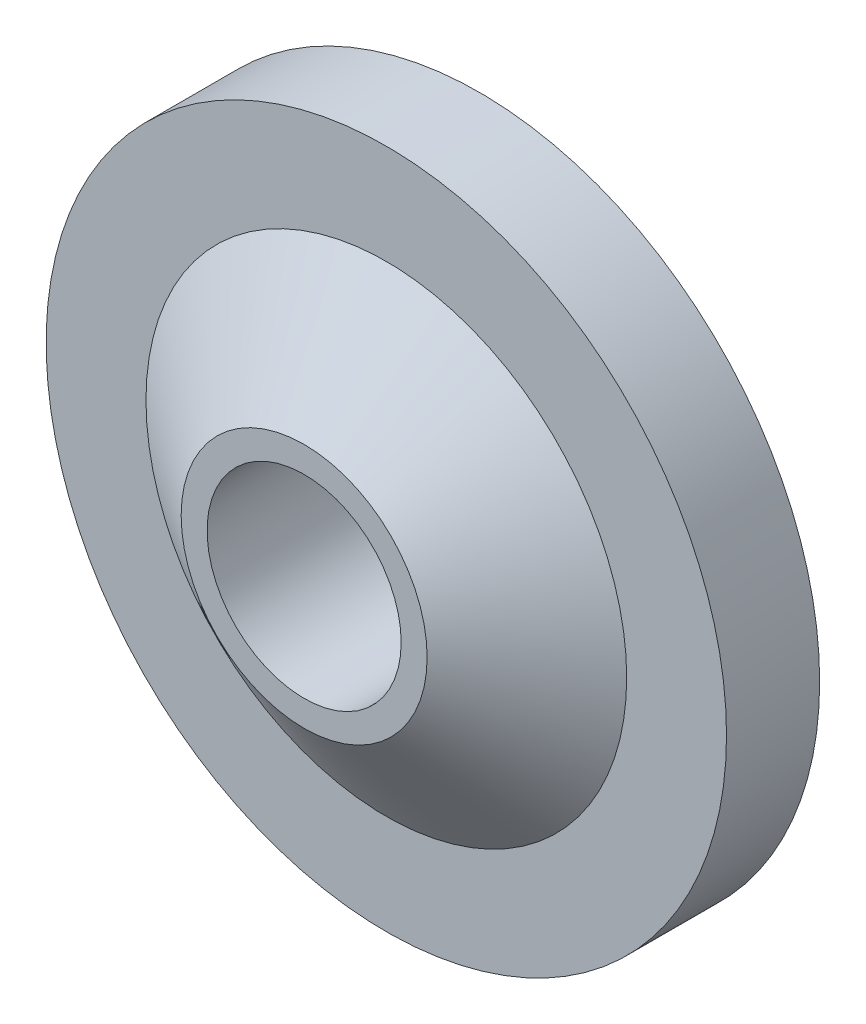
from build123d import *

# Parameters (mm, degrees)
SKETCH1_R                     = 62.09
BOSS_EXTRUDE1_DEPTH           = 17
BOSS_EXTRUDE1_OTHER_WAY_DEPTH = 10
BOSS_EXTRUDE1_OTHER_WAY_TAPER = 70
SKETCH2_R                     = 43.87
BOSS_EXTRUDE2_DEPTH           = 15
BOSS_EXTRUDE2_TAPER           = 55
SKETCH3_R                     = 17.71
CUT_EXTRUDE1_DEPTH            = 98.336202069


with BuildPart() as part:
    # Sketch1 → Boss-Extrude1 (new body)
    with BuildSketch(Plane.XY):
        Circle(SKETCH1_R)
    extrude(amount=BOSS_EXTRUDE1_DEPTH)

    # Sketch1 → Boss-Extrude1 other way (add)
    with BuildSketch(Plane.XY):
        Circle(SKETCH1_R)
    extrude(amount=-BOSS_EXTRUDE1_OTHER_WAY_DEPTH, taper=BOSS_EXTRUDE1_OTHER_WAY_TAPER)

    # Sketch2 → Boss-Extrude2 (add)
    with BuildSketch(Plane.XY.offset(17)):
        Circle(SKETCH2_R)
    extrude(amount=BOSS_EXTRUDE2_DEPTH, taper=BOSS_EXTRUDE2_TAPER)

    # Sketch3 → Cut-Extrude1 (cut, through all)
    with BuildSketch(Plane.XY.offset(32)):
        Circle(SKETCH3_R)
    extrude(amount=-CUT_EXTRUDE1_DEPTH, mode=Mode.SUBTRACT)


solid = part.part
